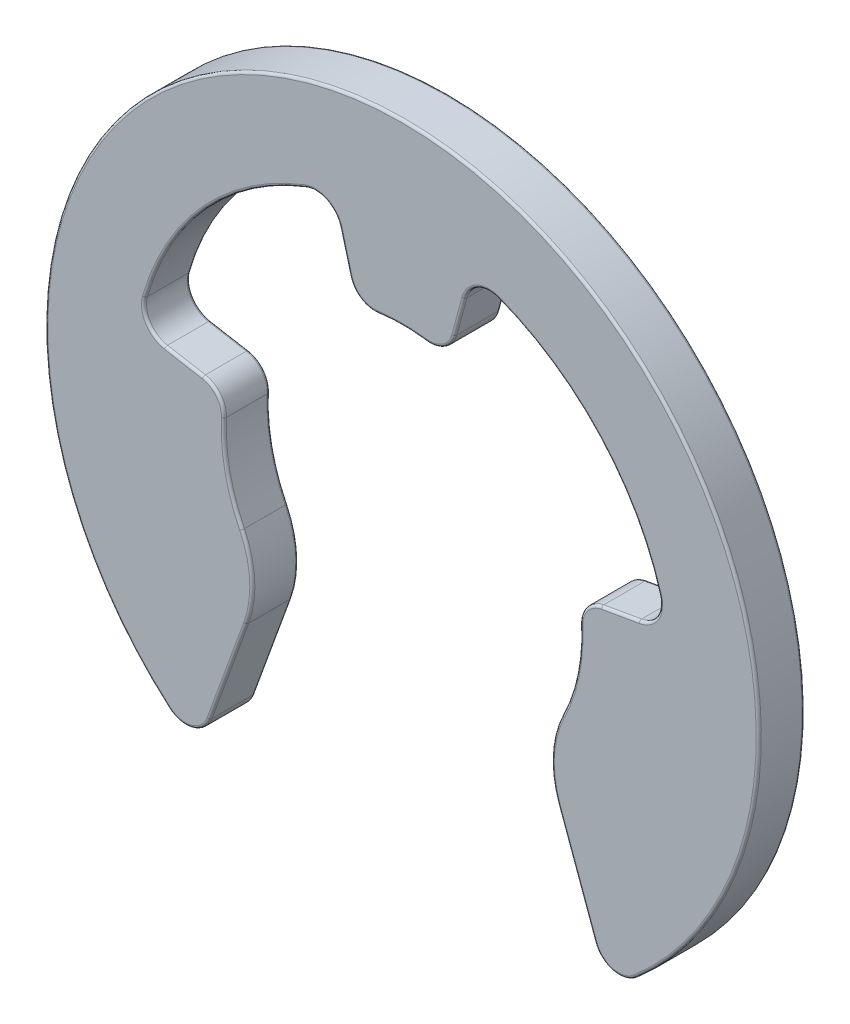
from build123d import *

# Parameters (mm, degrees)
EXTRUDE_1_DEPTH = 0.9
FILLET_1_R      = 0.05


with BuildPart() as part:
    # 草图1 → 凸台-拉伸1 (new body)
    with BuildSketch(Plane.XY):
        with BuildLine():
            Line((-3.058559184, -3.106168453), (-3.780252232, -5.089003807))
            ThreePointArc((-3.780252232, -5.089003807), (-4.12420475, -5.401884997), (-4.5770292, -5.296300946))
            ThreePointArc((-4.5770292, -5.296300946), (0, 7), (4.5770292, -5.296300946))
            ThreePointArc((4.5770292, -5.296300946), (4.12420475, -5.401884997), (3.780252232, -5.089003807))
            Line((3.780252232, -5.089003807), (3.058559184, -3.106168453))
            ThreePointArc((3.058559184, -3.106168453), (2.940804055, -2.315215391), (3.142328271, -1.541354288))
            ThreePointArc((3.142328271, -1.541354288), (3.427840369, -0.707043427), (3.495763858, 0.172148344))
            ThreePointArc((3.495763858, 0.172148344), (3.604346077, 0.508615135), (3.908334606, 0.689144841))
            Line((3.908334606, 0.689144841), (4.651848643, 0.820246426))
            ThreePointArc((4.651848643, 0.820246426), (4.989146446, 1.047847317), (5.045553455, 1.450824019))
            ThreePointArc((5.045553455, 1.450824019), (3.870706018, 3.54684859), (1.885052154, 4.899905956))
            ThreePointArc((1.885052154, 4.899905956), (1.478692705, 4.878835326), (1.222560464, 4.562657768))
            Line((1.222560464, 4.562657768), (1.027156242, 3.833399282))
            ThreePointArc((1.027156242, 3.833399282), (0.82081916, 3.546301722), (0.476169163, 3.467457704))
            ThreePointArc((0.476169163, 3.467457704), (0, 3.5), (-0.476169163, 3.467457704))
            ThreePointArc((-0.476169163, 3.467457704), (-0.82081916, 3.546301722), (-1.027156242, 3.833399282))
            Line((-1.027156242, 3.833399282), (-1.222560464, 4.562657768))
            ThreePointArc((-1.222560464, 4.562657768), (-1.478692705, 4.878835326), (-1.885052154, 4.899905956))
            ThreePointArc((-1.885052154, 4.899905956), (-3.870706018, 3.54684859), (-5.045553455, 1.450824019))
            ThreePointArc((-5.045553455, 1.450824019), (-4.989146446, 1.047847317), (-4.651848643, 0.820246426))
            Line((-4.651848643, 0.820246426), (-3.908334606, 0.689144841))
            ThreePointArc((-3.908334606, 0.689144841), (-3.604346077, 0.508615135), (-3.495763858, 0.172148344))
            ThreePointArc((-3.495763858, 0.172148344), (-3.427840369, -0.707043427), (-3.142328271, -1.541354288))
            ThreePointArc((-3.142328271, -1.541354288), (-2.940804055, -2.315215391), (-3.058559184, -3.106168453))
        make_face()
    extrude(amount=EXTRUDE_1_DEPTH)

    # 圆角1
    fillet_1_edges = [part.edges().sort_by_distance(p)[0] for p in [
        (-4.12420475, -5.401884997, 0.9),
        (-3.419405708, -4.09758613, 0.9),
        (-2.940804055, -2.315215391, 0.9),
        (3.419405708, -4.09758613, 0),
        (2.940804055, -2.315215391, 0),
        (3.427840369, -0.707043427, 0),
        (3.604346077, 0.508615135, 0),
        (4.280091624, 0.754695633, 0),
        (-3.427840369, -0.707043427, 0.9),
        (4.989146446, 1.047847317, 0),
        (3.870706018, 3.54684859, 0),
        (1.478692705, 4.878835326, 0),
        (1.124858353, 4.198028525, 0),
        (0.82081916, 3.546301722, 0),
        (0, 3.5, 0),
        (-0.82081916, 3.546301722, 0),
        (-1.124858353, 4.198028525, 0),
        (-1.478692705, 4.878835326, 0),
        (-3.870706018, 3.54684859, 0),
        (-3.604346077, 0.508615135, 0.9),
        (-4.989146446, 1.047847317, 0),
        (-4.280091624, 0.754695633, 0),
        (-3.604346077, 0.508615135, 0),
        (-3.427840369, -0.707043427, 0),
        (-2.940804055, -2.315215391, 0),
        (-3.419405708, -4.09758613, 0),
        (-4.12420475, -5.401884997, 0),
        (0, 7, 0),
        (4.12420475, -5.401884997, 0),
        (-4.280091624, 0.754695633, 0.9),
        (-4.989146446, 1.047847317, 0.9),
        (-3.870706018, 3.54684859, 0.9),
        (-1.478692705, 4.878835326, 0.9),
        (-1.124858353, 4.198028525, 0.9),
        (4.12420475, -5.401884997, 0.9),
        (-0.82081916, 3.546301722, 0.9),
        (0, 3.5, 0.9),
        (0.82081916, 3.546301722, 0.9),
        (1.124858353, 4.198028525, 0.9),
        (1.478692705, 4.878835326, 0.9),
        (3.870706018, 3.54684859, 0.9),
        (4.989146446, 1.047847317, 0.9),
        (4.280091624, 0.754695633, 0.9),
        (3.604346077, 0.508615135, 0.9),
        (3.427840369, -0.707043427, 0.9),
        (0, 7, 0.9),
        (2.940804055, -2.315215391, 0.9),
        (3.419405708, -4.09758613, 0.9),
    ]]
    fillet(fillet_1_edges, radius=FILLET_1_R)


solid = part.part
